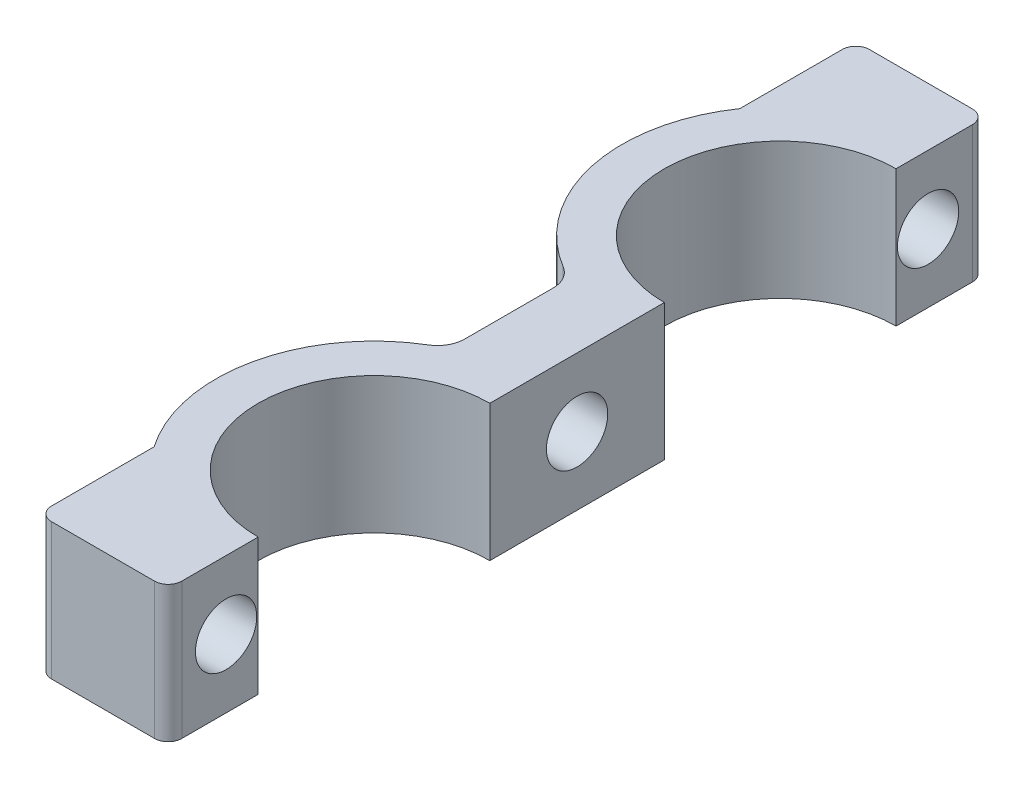
from build123d import *

# Parameters (mm, degrees)
EXTRUDE_1_DEPTH     = 10
EXTRUDE_START       = -10
EXTRUDE_2_DEPTH     = 10
EXTRUDE_4_DEPTH     = 10
SKETCH_3_R          = 2.25
CUT_EXTRUDE_4_DEPTH = 62.923824171
SKETCH_4_R          = 2.25
CUT_EXTRUDE_2_DEPTH = 62.184638595
FILLET_2_R          = 1
EXTRUDE_3_DEPTH     = 10
CUT_EXTRUDE_3_DEPTH = 62.923824171
FILLET_3_R          = 1
FILLET_4_R          = 2


with BuildPart() as part:
    # Эскиз1 → Бобышка-Вытянуть1 (new body)
    with BuildSketch(Plane(origin=(0, 0, 0), x_dir=(1, 0, 0), z_dir=(0, 1, 0))):
        with BuildLine():
            Line((0, 0), (0, 8))
            ThreePointArc((0, 8), (-7.1, 15.1), (0, 22.2))
            Line((0, 22.2), (0, 37.8))
            ThreePointArc((0, 37.8), (-7.1, 44.9), (0, 52))
            Line((0, 52), (0, 60))
            Line((0, 60), (-3, 60))
            Line((-3, 60), (-3, 54.544169223))
            ThreePointArc((-3, 54.544169223), (-10.1, 44.9), (-3, 35.255830777))
            Line((-3, 35.255830777), (-3, 24.744169223))
            ThreePointArc((-3, 24.744169223), (-10.1, 15.1), (-3, 5.455830777))
            Line((-3, 5.455830777), (-3, 0))
            Line((-3, 0), (0, 0))
        make_face()
    extrude(amount=EXTRUDE_1_DEPTH)

    # Эскиз2 → Бобышка-Вытянуть2 (add)
    with BuildSketch(Plane(origin=(0, 10, 0), x_dir=(1, 0, 0), z_dir=(0, 1, 0)).offset(EXTRUDE_START)):
        with BuildLine():
            Line((-3, 60), (-8.049844719, 60))
            Line((-8.049844719, 60), (-8.049844719, 51))
            ThreePointArc((-8.049844719, 51), (-5.802159163, 53.167100402), (-3, 54.544169223))
            Line((-3, 54.544169223), (-3, 60))
        make_face()
        with BuildLine():
            Line((-3, 0), (-3, 5.455830777))
            ThreePointArc((-3, 5.455830777), (-5.802159163, 6.832899598), (-8.049844719, 9))
            Line((-8.049844719, 9), (-8.049844719, 0))
            Line((-8.049844719, 0), (-3, 0))
        make_face()
    extrude(amount=EXTRUDE_2_DEPTH)

    # Эскиз9 → Бобышка-Вытянуть4 (add, through all)
    with BuildSketch(Plane.XZ):
        with BuildLine():
            Line((-5, -25.567091287), (-5, -34.432908713))
            ThreePointArc((-5, -34.432908713), (-11.207890559, -41.909483454), (-9.549844719, -51.484866426))
            Line((-9.549844719, -51.484866426), (-9.549844719, -60))
            Line((-9.549844719, -60), (-8.049844719, -60))
            Line((-8.049844719, -60), (-8.049844719, -51))
            ThreePointArc((-8.049844719, -51), (-9.617405222, -41.81527687), (-3, -35.255830777))
            Line((-3, -35.255830777), (-3, -24.744169223))
            ThreePointArc((-3, -24.744169223), (-9.617405222, -18.18472313), (-8.049844719, -9))
            Line((-8.049844719, -9), (-8.049844719, 0))
            Line((-8.049844719, 0), (-9.549844719, 0))
            Line((-9.549844719, 0), (-9.549844719, -8.515133574))
            ThreePointArc((-9.549844719, -8.515133574), (-11.207890559, -18.090516546), (-5, -25.567091287))
        make_face()
    extrude(amount=-EXTRUDE_4_DEPTH)

    # Эскиз3 → Вырез-Вытянуть4 (cut, through all)
    with BuildSketch(Plane.ZY):
        with Locations(Location((-55.75, 5, 0), (0, 0, 180))):
            Circle(SKETCH_3_R)
        with Locations(Location((-4.25, 5, 0), (0, 0, 180))):
            Circle(SKETCH_3_R)
    extrude(amount=CUT_EXTRUDE_4_DEPTH, mode=Mode.SUBTRACT)

    # Эскиз4 → Вырез-Вытянуть2 (cut, through all)
    with BuildSketch(Plane.ZY.offset(5)):
        with Locations((-30, 5)):
            Circle(SKETCH_4_R)
    extrude(amount=-CUT_EXTRUDE_2_DEPTH, mode=Mode.SUBTRACT)

    # Скругление2
    fillet_2_edges = [part.edges().sort_by_distance(p)[0] for p in [
        (0, 5, -60),
        (0, 5, 0),
    ]]
    fillet(fillet_2_edges, radius=FILLET_2_R)

    # Эскиз5 → Бобышка-Вытянуть3 (add, through all)
    with BuildSketch(Plane.XZ):
        with BuildLine():
            Line((0, -8), (0, -8.1))
            ThreePointArc((0, -8.1), (-7, -15.1), (0, -22.1))
            Line((0, -22.1), (0, -22.2))
            ThreePointArc((0, -22.2), (-7.1, -15.1), (0, -8))
        make_face()
        with BuildLine():
            Line((0, -51.9), (0, -52))
            ThreePointArc((0, -52), (-7.1, -44.9), (0, -37.8))
            Line((0, -37.8), (0, -37.9))
            ThreePointArc((0, -37.9), (-7, -44.9), (0, -51.9))
        make_face()
    extrude(amount=-EXTRUDE_3_DEPTH)

    # Эскиз7 → Вырез-Вытянуть3 (cut, through all)
    with BuildSketch(Plane(origin=(0, 10, 0), x_dir=(1, 0, 0), z_dir=(0, 1, 0))):
        with BuildLine():
            Line((0, 51.9), (0, 53.4))
            ThreePointArc((0, 53.4), (-8.5, 44.9), (0, 36.4))
            Line((0, 36.4), (0, 37.9))
            ThreePointArc((0, 37.9), (-7, 44.9), (0, 51.9))
        make_face()
        with BuildLine():
            Line((0, 22.1), (0, 23.6))
            ThreePointArc((0, 23.6), (-8.5, 15.1), (0, 6.6))
            Line((0, 6.6), (0, 8.1))
            ThreePointArc((0, 8.1), (-7, 15.1), (0, 22.1))
        make_face()
    extrude(amount=-CUT_EXTRUDE_3_DEPTH, mode=Mode.SUBTRACT)

    # Скругление3
    fillet_3_edges = [part.edges().sort_by_distance(p)[0] for p in [
        (-9.549844719, 5, 0),
        (-9.549844719, 5, -60),
    ]]
    fillet(fillet_3_edges, radius=FILLET_3_R)

    # Скругление4
    fillet_4_edges = [part.edges().sort_by_distance(p)[0] for p in [
        (-5, 5, -34.432908713),
        (-5, 5, -25.567091287),
    ]]
    fillet(fillet_4_edges, radius=FILLET_4_R)


solid = part.part
